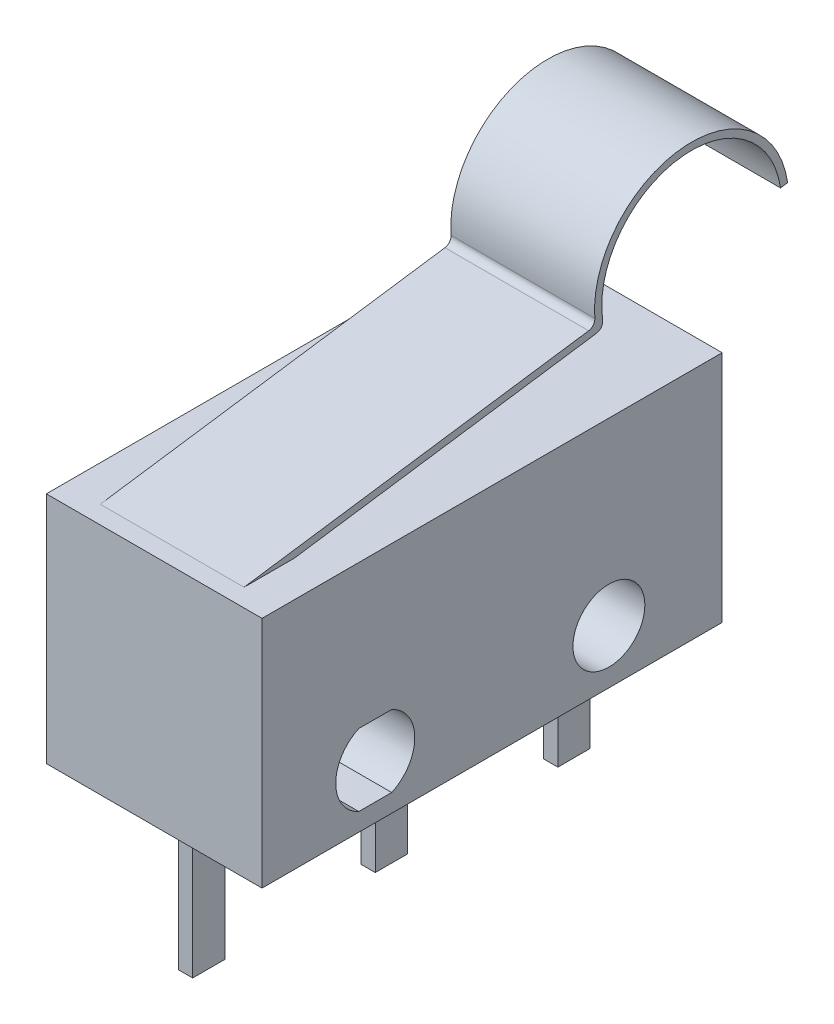
from build123d import *

# Parameters (mm, degrees)
SKETCH1_W           = 12.8
SKETCH1_H           = 6.5
SKETCH1_R           = 1
BOSS_EXTRUDE1_DEPTH = 3
SKETCH3_W           = 0.9
SKETCH3_H           = 4
BOSS_EXTRUDE2_DEPTH = 0.2
BOSS_EXTRUDE3_DEPTH = 2
FILLET1_R           = 0.2
BOSS_EXTRUDE5_DEPTH = 0.5


with BuildPart() as part:
    # Sketch1 → Boss-Extrude1 (new, symmetric)
    with BuildSketch(Plane(origin=(0, 0, 0), x_dir=(0, 0, -1), z_dir=(1, 0, 0))):
        Rectangle(SKETCH1_W, SKETCH1_H)
        with Locations((3.25, -1.75)):
            Circle(SKETCH1_R, mode=Mode.SUBTRACT)
        with BuildLine():
            Line((-3.708257569, -0.75), (-2.791742431, -0.75))
            ThreePointArc((-2.791742431, -0.75), (-2.15, -1.75), (-2.791742431, -2.75))
            Line((-2.791742431, -2.75), (-3.708257569, -2.75))
            ThreePointArc((-3.708257569, -2.75), (-4.35, -1.75), (-3.708257569, -0.75))
        make_face(mode=Mode.SUBTRACT)
    extrude(amount=BOSS_EXTRUDE1_DEPTH, both=True)

    # Sketch3 → Boss-Extrude2 (add, symmetric)
    with BuildSketch(Plane(origin=(0, 0, 0), x_dir=(0, 0, -1), z_dir=(1, 0, 0))):
        with Locations((-5.08, -5.25)):
            Rectangle(SKETCH3_W, SKETCH3_H)
        with Locations((0, -5.25)):
            Rectangle(SKETCH3_W, SKETCH3_H)
        with Locations((5.08, -5.25)):
            Rectangle(SKETCH3_W, SKETCH3_H)
    extrude(amount=BOSS_EXTRUDE2_DEPTH, both=True)

    # Sketch4 → Boss-Extrude3 (add, symmetric)
    with BuildSketch(Plane(origin=(0, 0, 0), x_dir=(0, 0, -1), z_dir=(1, 0, 0))):
        with BuildLine():
            Line((-5.9, 3.25), (3.877784075, 4.663655529))
            ThreePointArc((3.877784075, 4.663655529), (6.163655529, 7.722215925), (9.222215925, 5.436344471))
            Line((9.222215925, 5.436344471), (9.024274005, 5.407726362))
            ThreePointArc((9.024274005, 5.407726362), (6.093510034, 7.507970079), (4.11227449, 4.495478279))
            Line((4.11227449, 4.495478279), (-4.502283608, 3.25))
            Line((-4.502283608, 3.25), (-5.9, 3.25))
        make_face()
    extrude(amount=BOSS_EXTRUDE3_DEPTH, both=True)

    # Fillet1
    fillet1_edges = [part.edges().sort_by_distance(p)[0] for p in [
        (0, 4.495478279, -4.11227449),
        (0, 4.663655529, -3.877784075),
    ]]
    fillet(fillet1_edges, radius=FILLET1_R)

    # Sketch5 → Boss-Extrude5 (add, symmetric)
    with BuildSketch(Plane(origin=(0, 0, 0), x_dir=(0, 0, -1), z_dir=(1, 0, 0))):
        with BuildLine():
            Line((-2.48, 3.25), (-1.82, 3.25))
            ThreePointArc((-1.82, 3.25), (-2.15, 3.58), (-2.48, 3.25))
        make_face()
    extrude(amount=BOSS_EXTRUDE5_DEPTH, both=True)


solid = part.part
